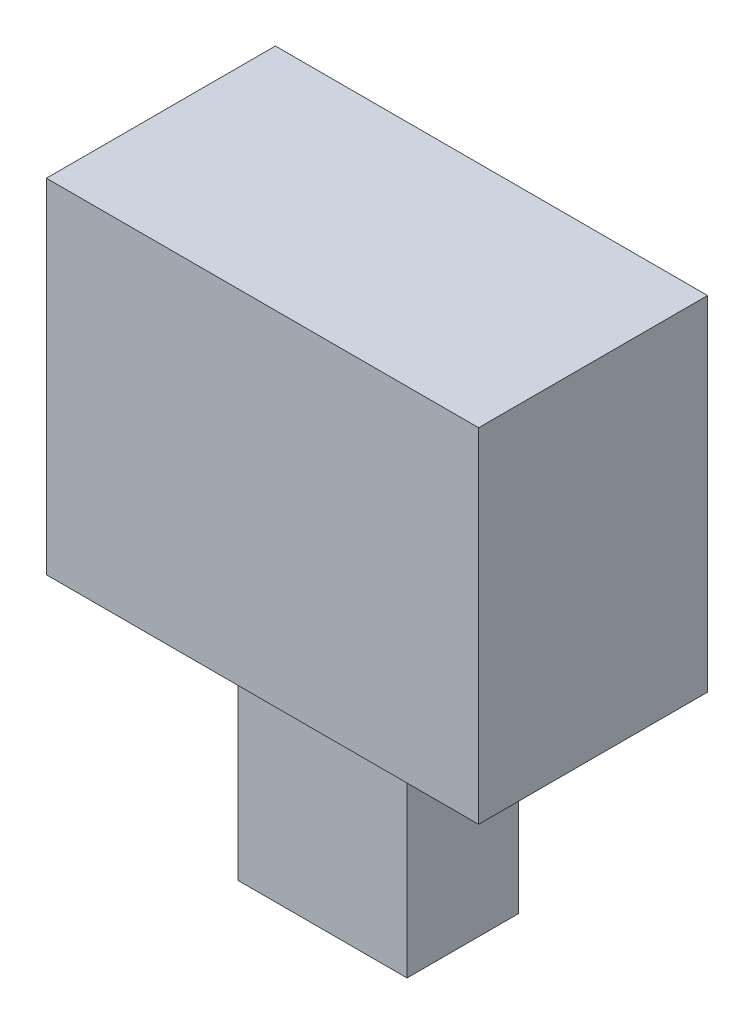
from build123d import *

# Parameters (mm, degrees)
SKETCH1_W                = 14.75
SKETCH1_H                = 9.75
BOSS_EXTRUDE1_DEPTH      = 50
BOSS_EXTRUDE2_DEPTH      = 18.875
BOSS_EXTRUDE2_DEPTH_BACK = 18.875


with BuildPart() as part:
    # Sketch1 → Boss-Extrude1 (new body)
    with BuildSketch(Plane(origin=(0, 0, 0), x_dir=(1, 0, 0), z_dir=(0, 1, 0))):
        with Locations((0, -0.125)):
            Rectangle(SKETCH1_W, SKETCH1_H)
    extrude(amount=BOSS_EXTRUDE1_DEPTH)

    # Sketch3 → Boss-Extrude2 (add, two sides: drawn at the far end of the back side and taken through both)
    with BuildSketch(Plane(origin=(0, 0, 0), x_dir=(0, 0, -1), z_dir=(1, 0, 0)).offset(-BOSS_EXTRUDE2_DEPTH_BACK)):
        Polygon((-10.25, 20), (-5.25, 20), (9.75, 20), (9.75, 50), (-10.25, 50), align=None)
    extrude(amount=BOSS_EXTRUDE2_DEPTH + BOSS_EXTRUDE2_DEPTH_BACK)


solid = part.part
